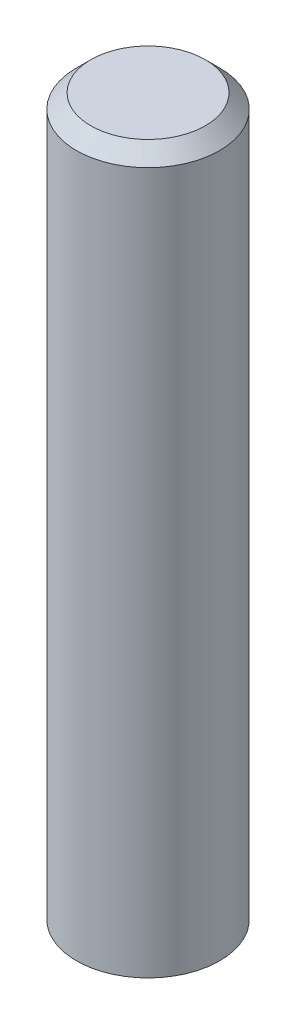
from build123d import *


with BuildPart() as part:
    # Croquis1 → Revolución1 (revolve)
    with BuildSketch(Plane.XY, mode=Mode.PRIVATE) as revoluci_n1_sk:
        Polygon((0, 24.5), (0, 25), (-2, 25), (-2.5, 24.5), (-2.5, 0), (-2, 0), (-2, 24.5), align=None)
    revolve(revoluci_n1_sk.sketch.rotate(Axis((0, 0, 0), (0, 1, 0)), 270), axis=Axis((0, 0, 0), (0, 1, 0)))


solid = part.part
